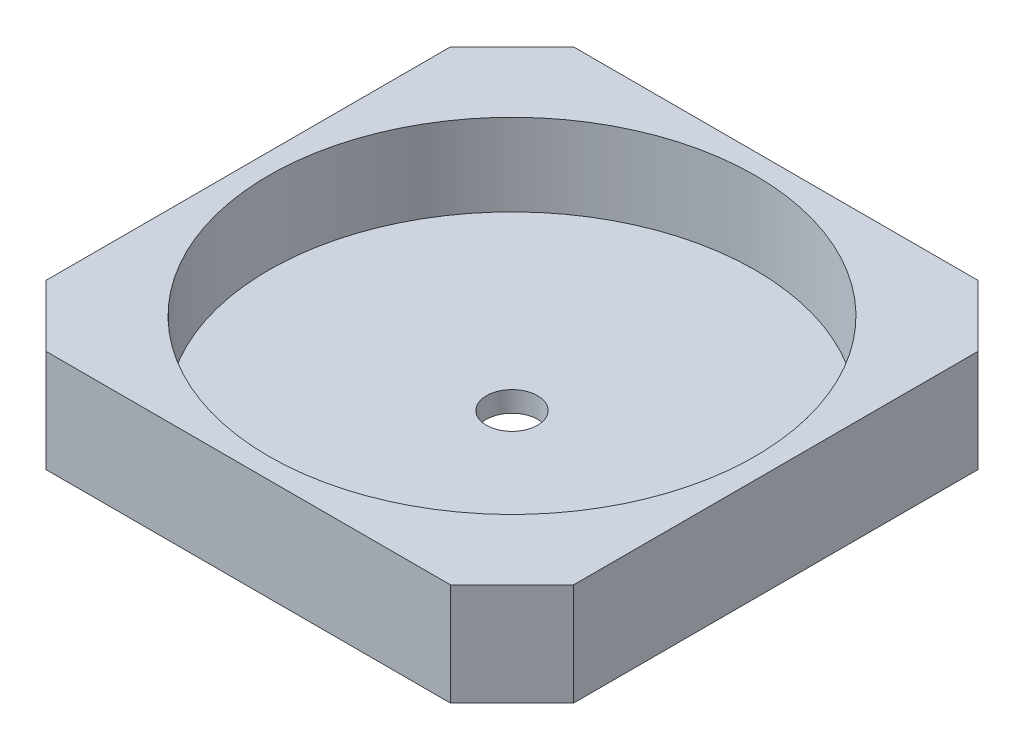
from build123d import *

# Parameters (mm, degrees)
SKETCH_1_R      = 118.75
EXTRUDE_1_DEPTH = 50
SKETCH_2_R      = 12.5
EXTRUDE_2_DEPTH = 10


with BuildPart() as part:
    # 草圖1 → 填料-伸長1 (new body)
    with BuildSketch(Plane(origin=(0, 0, 0), x_dir=(1, 0, 0), z_dir=(0, 1, 0))):
        Polygon((98.75, 128.75), (128.75, 98.75), (128.75, -98.75), (98.75, -128.75), (-98.75, -128.75), (-128.75, -98.75), (-128.75, 98.75), (-98.75, 128.75), align=None)
        with Locations(Location((0, 0, 0), (0, 0, 270))):
            Circle(SKETCH_1_R, mode=Mode.SUBTRACT)
    extrude(amount=EXTRUDE_1_DEPTH)

    # 草圖2 → 填料-伸長2 (add)
    with BuildSketch(Plane.XZ):
        Polygon((98.75, -128.75), (128.75, -98.75), (128.75, 98.75), (98.75, 128.75), (-98.75, 128.75), (-128.75, 98.75), (-128.75, -98.75), (-98.75, -128.75), align=None)
        with Locations(Location((0, 0, 0), (0, 0, 270))):
            Circle(SKETCH_2_R, mode=Mode.SUBTRACT)
    extrude(amount=-EXTRUDE_2_DEPTH)


solid = part.part
